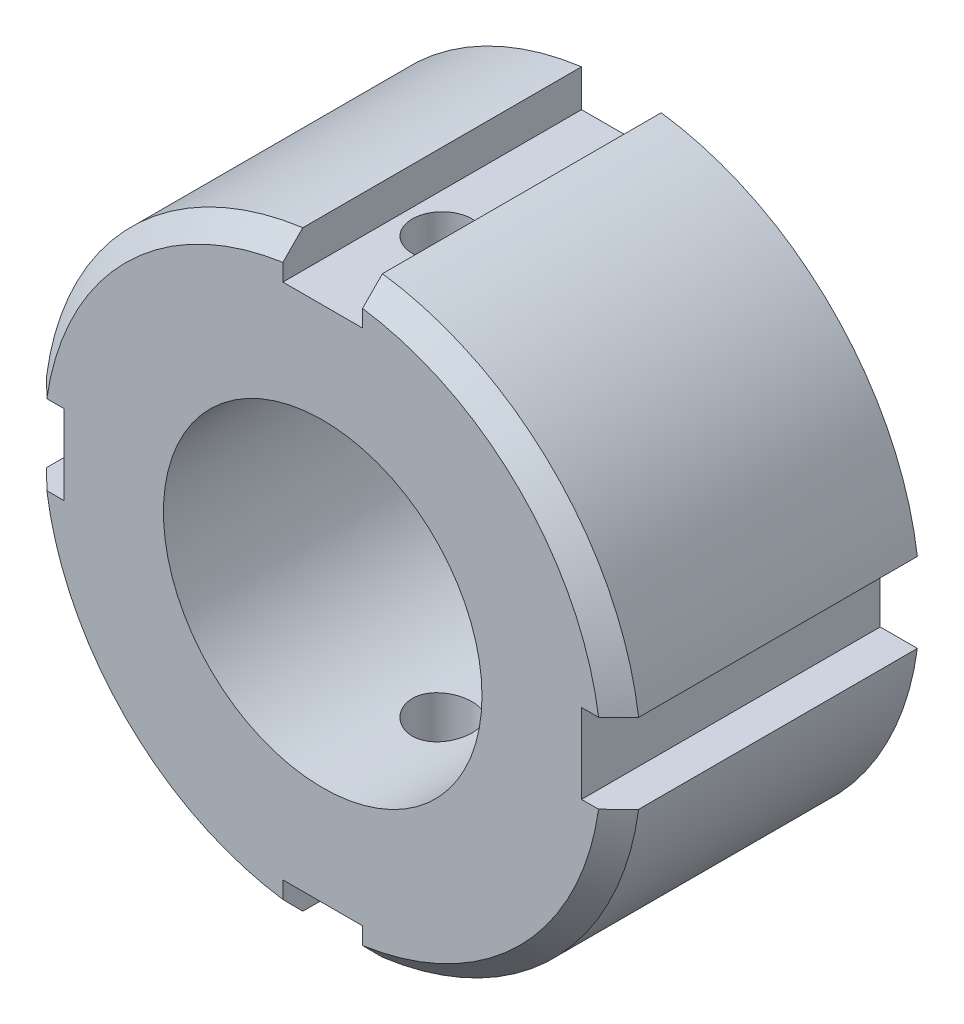
from build123d import *

# Parameters (mm, degrees)
SKETCH1_R           = 15
BOSS_EXTRUDE1_DEPTH = 7.5
SKETCH2_R           = 8
CUT_EXTRUDE1_DEPTH  = 26.980762114
SKETCH3_W           = 4
SKETCH3_H           = 4
CUT_EXTRUDE2_DEPTH  = 15
CHAMFER1_SIZE       = 1
SKETCH4_R           = 1.5
CUT_EXTRUDE3_DEPTH  = 33.461789652


with BuildPart() as part:
    # Sketch1 → Boss-Extrude1 (new, symmetric)
    with BuildSketch(Plane.XY):
        Circle(SKETCH1_R)
    extrude(amount=BOSS_EXTRUDE1_DEPTH, both=True)

    # Sketch2 → Cut-Extrude1 (cut, through all)
    with BuildSketch(Plane.XY.offset(7.5)):
        Circle(SKETCH2_R)
    extrude(amount=-CUT_EXTRUDE1_DEPTH, mode=Mode.SUBTRACT)

    # Sketch3 → Cut-Extrude2 (cut)
    with BuildSketch(Plane.XY.offset(7.5)):
        with Locations((15, 0)):
            Rectangle(SKETCH3_W, SKETCH3_H)
        with Locations((0, 15)):
            Rectangle(SKETCH3_W, SKETCH3_H)
        with Locations((0, -15)):
            Rectangle(SKETCH3_W, SKETCH3_H)
        with Locations((-15, 0)):
            Rectangle(SKETCH3_W, SKETCH3_H)
    extrude(amount=-CUT_EXTRUDE2_DEPTH, mode=Mode.SUBTRACT)

    # Chamfer1
    chamfer1_edges = [part.edges().sort_by_distance(p)[0] for p in [
        (10.606601718, -10.606601718, 7.5),
        (10.606601718, 10.606601718, 7.5),
        (-10.606601718, -10.606601718, 7.5),
        (-10.606601718, 10.606601718, 7.5),
    ]]
    chamfer(chamfer1_edges, length=CHAMFER1_SIZE)

    # Sketch4 → Cut-Extrude3 (cut, through all)
    with BuildSketch(Plane.XZ.offset(13)):
        with Locations((0, 1.5)):
            Circle(SKETCH4_R)
    extrude(amount=-CUT_EXTRUDE3_DEPTH, mode=Mode.SUBTRACT)


solid = part.part
